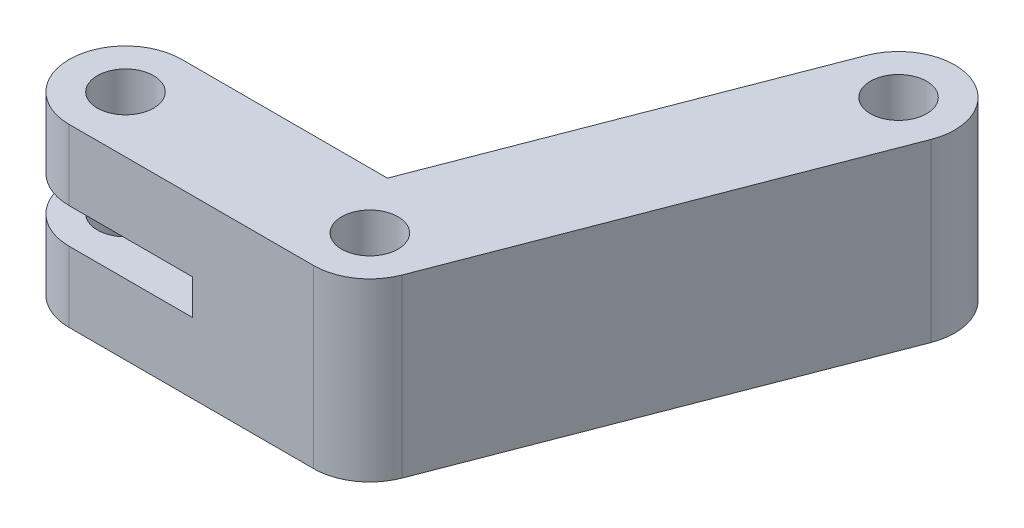
from build123d import *

# Parameters (mm, degrees)
SKETCH1_R           = 4
BOSS_EXTRUDE1_DEPTH = 12.5
CUT_EXTRUDE1_REACH  = 85.156
SKETCH4_W           = 25.5
SKETCH4_H           = 5
SKETCH5_R           = 4
CUT_EXTRUDE2_DEPTH  = 80.522425


with BuildPart() as part:
    # Sketch1 → Boss-Extrude1 (new, symmetric)
    # profile 1 of 3: a face of its own
    with BuildSketch(Plane(origin=(0, 0, 0), x_dir=(1, 0, 0), z_dir=(0, 1, 0))):
        Circle(SKETCH1_R)
    # profile 2 of 3: a face of its own
    with BuildSketch(Plane(origin=(0, 0, 0), x_dir=(1, 0, 0), z_dir=(0, 1, 0))):
        with BuildLine():
            Line((-34.72, 8), (0, 8))
            ThreePointArc((0, 8), (8, 0), (0, -8))
            Line((0, -8), (-34.72, -8))
            ThreePointArc((-34.72, -8), (-42.72, 0), (-34.72, 8))
        make_face()
        with Locations(Location((-34.72, 0, 0), (0, 0, 270))):
            Circle(SKETCH1_R, mode=Mode.SUBTRACT)
    # profile 3 of 3: a face of its own
    with BuildSketch(Plane(origin=(0, 0, 0), x_dir=(1, 0, 0), z_dir=(0, 1, 0))):
        with BuildLine():
            Line((-7.465452, 2.875245), (13.424548, 57.115245))
            ThreePointArc((13.424548, 57.115245), (23.765245, 61.705452), (28.355452, 51.364755))
            Line((28.355452, 51.364755), (7.465452, -2.875245))
            ThreePointArc((7.465452, -2.875245), (-2.875245, -7.465452), (-7.465452, 2.875245))
        make_face()
        with Locations(Location((20.89, 54.24, 0), (0, 0, 270))):
            Circle(SKETCH1_R, mode=Mode.SUBTRACT)
    extrude(amount=BOSS_EXTRUDE1_DEPTH, both=True)

    # Sketch4 → Cut-Extrude1 (cut, up to next)
    with BuildSketch(Plane.XY.offset(8), mode=Mode.PRIVATE) as cut_extrude1_sk1:
        with Locations((-29.97, 0)):
            Rectangle(SKETCH4_W, SKETCH4_H)
    cut_extrude1_tool1 = extrude(cut_extrude1_sk1.sketch, amount=-CUT_EXTRUDE1_REACH, mode=Mode.PRIVATE) & part.part
    add(cut_extrude1_tool1.solids().sort_by_distance((-29.97, 0, 8))[0], mode=Mode.SUBTRACT)

    # Sketch5 → Cut-Extrude2 (cut, through all)
    with BuildSketch(Plane(origin=(0, 12.5, 0), x_dir=(1, 0, 0), z_dir=(0, 1, 0))):
        with Locations(Location((0, 0, 0), (0, 0, 270))):
            Circle(SKETCH5_R)
    extrude(amount=-CUT_EXTRUDE2_DEPTH, mode=Mode.SUBTRACT)


solid = part.part
